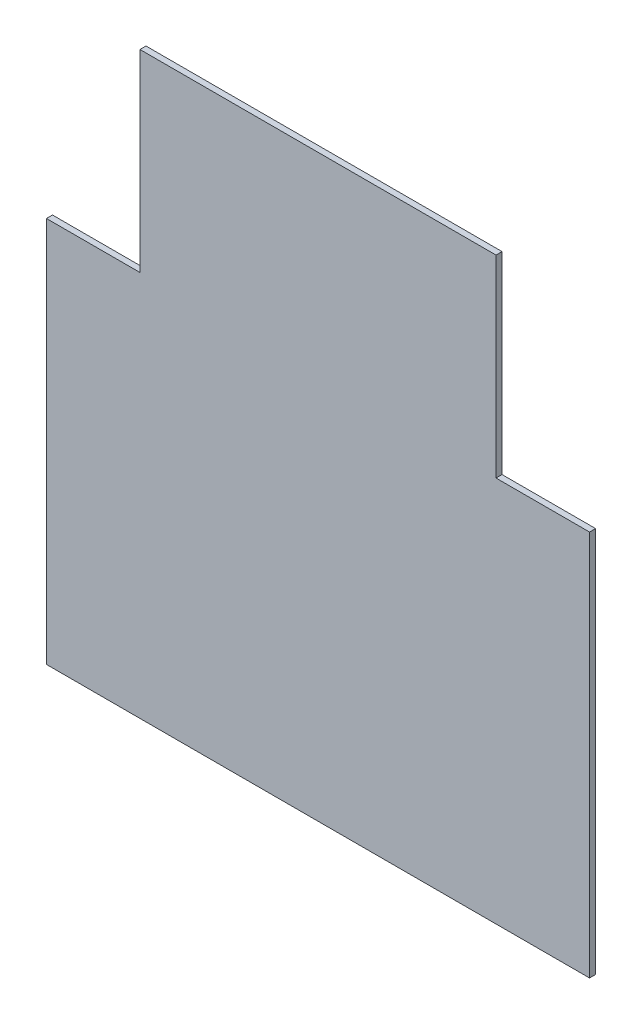
from build123d import *

# Parameters (mm, degrees)
BOSS_EXTRUDE1_DEPTH = 3.175


with BuildPart() as part:
    # Sketch1 → Boss-Extrude1 (new body)
    with BuildSketch(Plane.XY):
        Polygon((93.6625, 101.6), (142.875, 101.6), (142.875, -101.6), (-142.875, -101.6), (-142.875, 101.6), (-93.6625, 101.6), (-93.6625, 203.2), (93.6625, 203.2), align=None)
    extrude(amount=BOSS_EXTRUDE1_DEPTH)


solid = part.part
